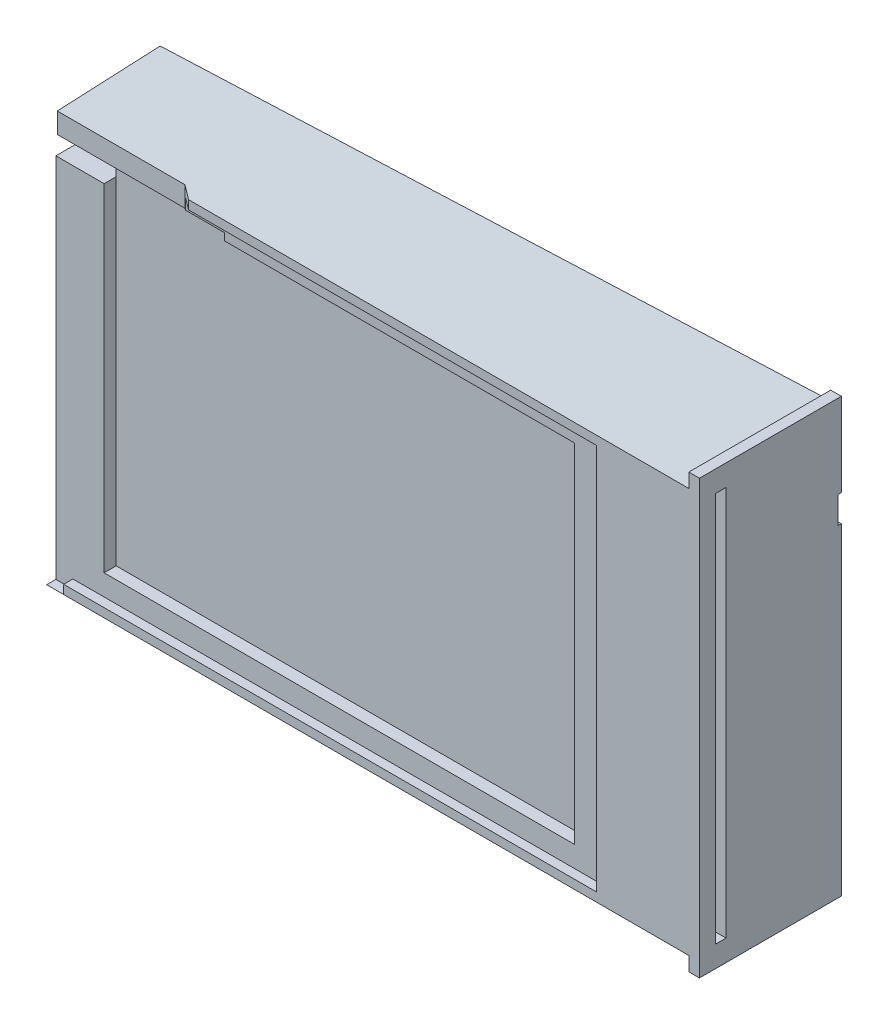
from build123d import *

# Parameters (mm, degrees)
SKETCH6_W               = 17
SKETCH6_H               = 1
SKETCH6_W_2             = 66.3
SKETCH6_H_2             = 49
FILM_PLANE_DEPTH        = 3
CUT_EXTRUDE2_DEPTH      = 1.3
NOTCH_W                 = 6.8
NOTCH_H                 = 2.5
NOTCH_CUT_DEPTH         = 4.1
SKETCH10_W              = 6.297854397
SKETCH10_H              = 3.8
CUT_EXTRUDE4_DEPTH      = 0.5
CUT_EXTRUDE5_DEPTH      = 1.5
CUT_EXTRUDE6_DEPTH      = 111.449366381
CUT_EXTRUDE6_DEPTH_BACK = 5
SKETCH_1_W              = 1.5
SKETCH_1_H              = 55
OUTLET_DEPTH            = 2
SKETCH_6_W              = 1.5
SKETCH_6_H              = 2
EXTRUDE_1_DEPTH         = 20


with BuildPart() as part:
    # Sketch3 → body section 0
    with BuildSketch(Plane(origin=(0, 0, 0), x_dir=(0, 0, -1), z_dir=(1, 0, 0))):
        with BuildLine():
            Line((0, 61), (16, 61.75))
            Line((16, 61.75), (16, 3.25))
            Line((16, 3.25), (0, 4))
            Line((0, 4), (0, 61))
        make_face()
    # Sketch2 → body section 1
    with BuildSketch(Plane(origin=(92, 0, 0), x_dir=(0, 0, -1), z_dir=(1, 0, 0))):
        with BuildLine():
            Line((0, 61), (20, 61.75))
            Line((20, 61.75), (20, 3.25))
            Line((20, 3.25), (0, 4))
            Line((0, 4), (0, 61))
        make_face()
    loft()

    # Sketch6 → film plane (cut)
    with BuildSketch(Plane.XY):
        with Locations((15.3, 57.7)):
            Rectangle(SKETCH6_W, SKETCH6_H)
        with Locations((39.95, 32.7)):
            Rectangle(SKETCH6_W_2, SKETCH6_H_2)
    extrude(amount=-FILM_PLANE_DEPTH, mode=Mode.SUBTRACT)

    # Sketch7 → Cut-Extrude2 (cut)
    with BuildSketch(Plane.XY):
        Polygon((77.5, 5.25), (77.5, 59.75), (0, 59.75), (0, 4), (2.4, 4), (2.4, 5.25), align=None)
        Polygon((23.8, 58.2), (23.8, 57.2), (73.1, 57.2), (73.1, 8.2), (6.8, 8.2), (6.8, 58.2), align=None, mode=Mode.SUBTRACT)
    extrude(amount=-CUT_EXTRUDE2_DEPTH, mode=Mode.SUBTRACT)

    # notch → notch-cut (cut)
    with BuildSketch(Plane.XY.offset(-1.3)):
        with Locations((3.4, 56.95)):
            Rectangle(NOTCH_W, NOTCH_H)
    extrude(amount=-NOTCH_CUT_DEPTH, mode=Mode.SUBTRACT)

    # Sketch10 → Cut-Extrude4 (cut)
    with BuildSketch(Plane(origin=(-0.694339623, 0, -15.969811321), x_dir=(-0.9990561583550596, 0, 0.04343722427630701), z_dir=(-0.043437224276307015, 0, -0.9990561583550597))):
        with Locations((-89.632983856, 49.35)):
            Rectangle(SKETCH10_W, SKETCH10_H)
    extrude(amount=-CUT_EXTRUDE4_DEPTH, mode=Mode.SUBTRACT)

    # Sketch11 → Cut-Extrude5 (cut)
    with BuildSketch(Plane(origin=(-0.694339623, 0, -15.969811321), x_dir=(-0.9990561583550596, 0, 0.04343722427630701), z_dir=(-0.043437224276307015, 0, -0.9990561583550597))):
        with BuildLine():
            Line((-72.5, 14.5), (-64, 14.5))
            ThreePointArc((-64, 14.5), (-62.232233047, 15.232233047), (-61.5, 17))
            Line((-61.5, 17), (-61.5, 48))
            ThreePointArc((-61.5, 48), (-62.232233047, 49.767766953), (-64, 50.5))
            Line((-64, 50.5), (-72.5, 50.5))
            ThreePointArc((-72.5, 50.5), (-74.267766953, 49.767766953), (-75, 48))
            Line((-75, 48), (-75, 17))
            ThreePointArc((-75, 17), (-74.267766953, 15.232233047), (-72.5, 14.5))
        make_face()
        with BuildLine():
            Line((-24.5, 14.5), (-16, 14.5))
            ThreePointArc((-16, 14.5), (-14.232233047, 15.232233047), (-13.5, 17))
            Line((-13.5, 17), (-13.5, 48))
            ThreePointArc((-13.5, 48), (-14.232233047, 49.767766953), (-16, 50.5))
            Line((-16, 50.5), (-24.5, 50.5))
            ThreePointArc((-24.5, 50.5), (-26.267766953, 49.767766953), (-27, 48))
            Line((-27, 48), (-27, 17))
            ThreePointArc((-27, 17), (-26.267766953, 15.232233047), (-24.5, 14.5))
        make_face()
    extrude(amount=-CUT_EXTRUDE5_DEPTH, mode=Mode.SUBTRACT)

    # Sketch5 → Cut-Extrude6 (cut, two sides: drawn at the far end of the back side and taken through both)
    with BuildSketch(Plane(origin=(0, 61, 0), x_dir=(1, 0, 0), z_dir=(0, 1, 0)).offset(-CUT_EXTRUDE6_DEPTH_BACK)):
        Polygon((0, 1.5), (18, 1.5), (20, 0), (0, 0), align=None)
    extrude(amount=CUT_EXTRUDE6_DEPTH + CUT_EXTRUDE6_DEPTH_BACK, mode=Mode.SUBTRACT)

    # 草图1 → outlet (cut)
    with BuildSketch(Plane(origin=(92, 0, 0), x_dir=(0, 0, -1), z_dir=(1, 0, 0))):
        with Locations((3, 32.5)):
            Rectangle(SKETCH_1_W, SKETCH_1_H)
    extrude(amount=-OUTLET_DEPTH, mode=Mode.SUBTRACT)

    # 草图6 → 凸台-拉伸1 (add)
    with BuildSketch(Plane.XY):
        with Locations((91.25, 62)):
            Rectangle(SKETCH_6_W, SKETCH_6_H)
        with Locations((91.25, 3)):
            Rectangle(SKETCH_6_W, SKETCH_6_H)
    extrude(amount=-EXTRUDE_1_DEPTH)


solid = part.part
